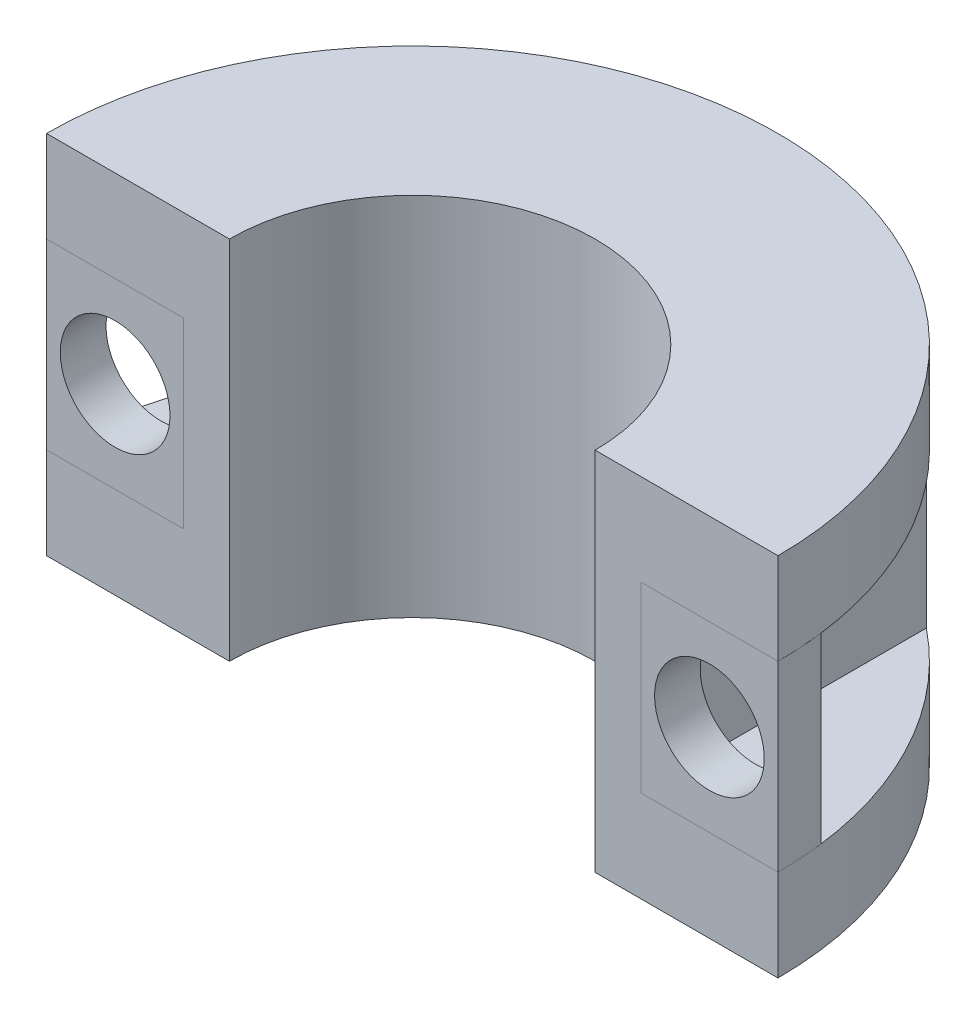
from build123d import *

# Parameters (mm, degrees)
BOSS_EXTRUDE1_DEPTH   = 8
SKETCH2_W             = 3
SKETCH2_H             = 3.993853132
CUT_EXTRUDE1_DEPTH    = 10
SKETCH3_W             = 3
SKETCH3_H             = 3.993853132
BOSS_EXTRUDE2_DEPTH   = 1
BOSS_EXTRUDE2_2_DEPTH = 1
CUT_EXTRUDE2_DEPTH    = 8
SKETCH5_R             = 1.2
CUT_EXTRUDE3_DEPTH    = 1


with BuildPart() as part:
    # Sketch1 → Boss-Extrude1 (new body)
    with BuildSketch(Plane(origin=(0, 0, 0), x_dir=(1, 0, 0), z_dir=(0, 1, 0))):
        with BuildLine():
            Line((-8, -1.5), (-4, -1.5))
            ThreePointArc((-4, -1.5), (0, 2.5), (4, -1.5))
            Line((4, -1.5), (8, -1.5))
            ThreePointArc((8, -1.5), (0, 6.5), (-8, -1.5))
        make_face()
    extrude(amount=BOSS_EXTRUDE1_DEPTH)

    # Sketch2 → Cut-Extrude1 (cut)
    with BuildSketch(Plane.XY.offset(1.5)):
        Polygon((-8, 4), (-8, 6), (-5, 6), (-5, 2.006146868), (-8, 2.006146868), align=None)
        with Locations((6.5, 4.003073434)):
            Rectangle(SKETCH2_W, SKETCH2_H)
    extrude(amount=-CUT_EXTRUDE1_DEPTH, mode=Mode.SUBTRACT)


with BuildPart() as body_2:
    # Sketch3 → Boss-Extrude2 (new body)
    with BuildSketch(Plane.XY.offset(1.5)):
        with Locations((-6.5, 4.003073434)):
            Rectangle(SKETCH3_W, SKETCH3_H)
    extrude(amount=-BOSS_EXTRUDE2_DEPTH)


with BuildPart() as body_3:
    # Sketch3 → Boss-Extrude2 2 (new body)
    with BuildSketch(Plane.XY.offset(1.5)):
        with Locations((6.5, 4.003073434)):
            Rectangle(SKETCH3_W, SKETCH3_H)
    extrude(amount=-BOSS_EXTRUDE2_2_DEPTH)


with BuildPart() as cut_extrude2_tool:
    # Sketch4 → Cut-Extrude2 (new body)
    with BuildSketch(Plane.XZ):
        with BuildLine():
            ThreePointArc((-7.937253933, 0.5), (-7.984298074, 0.9990167), (-8, 1.5))
            Line((-8, 1.5), (-8, 0.5))
            Line((-8, 0.5), (-7.937253933, 0.5))
        make_face()
        with BuildLine():
            ThreePointArc((8, 1.5), (7.984298074, 0.9990167), (7.937253933, 0.5))
            Line((7.937253933, 0.5), (8, 0.5))
            Line((8, 0.5), (8, 1.5))
        make_face()
    extrude(amount=-CUT_EXTRUDE2_DEPTH)


with BuildPart() as body_2_1:
    add(body_2.part)

    # Cut-Extrude2: cut by cut_extrude2_tool
    add(cut_extrude2_tool.part, mode=Mode.SUBTRACT)


with BuildPart() as body_3_1:
    add(body_3.part)

    # Cut-Extrude2: cut by cut_extrude2_tool
    add(cut_extrude2_tool.part, mode=Mode.SUBTRACT)


with BuildPart() as cut_extrude3_tool:
    # Sketch5 → Cut-Extrude3 (new body)
    with BuildSketch(Plane(origin=(0, 0, 0.5), x_dir=(-1, 0, 0), z_dir=(0, 0, -1))):
        with Locations((6.5, 4.003073434)):
            Circle(SKETCH5_R)
        with Locations((-6.5, 4.003073434)):
            Circle(SKETCH5_R)
    extrude(amount=-CUT_EXTRUDE3_DEPTH)


with BuildPart() as body_2_2:
    add(body_2_1.part)

    # Cut-Extrude3: cut by cut_extrude3_tool
    add(cut_extrude3_tool.part, mode=Mode.SUBTRACT)


with BuildPart() as body_3_2:
    add(body_3_1.part)

    # Cut-Extrude3: cut by cut_extrude3_tool
    add(cut_extrude3_tool.part, mode=Mode.SUBTRACT)


solid = Compound([part.part, body_2_2.part, body_3_2.part])
